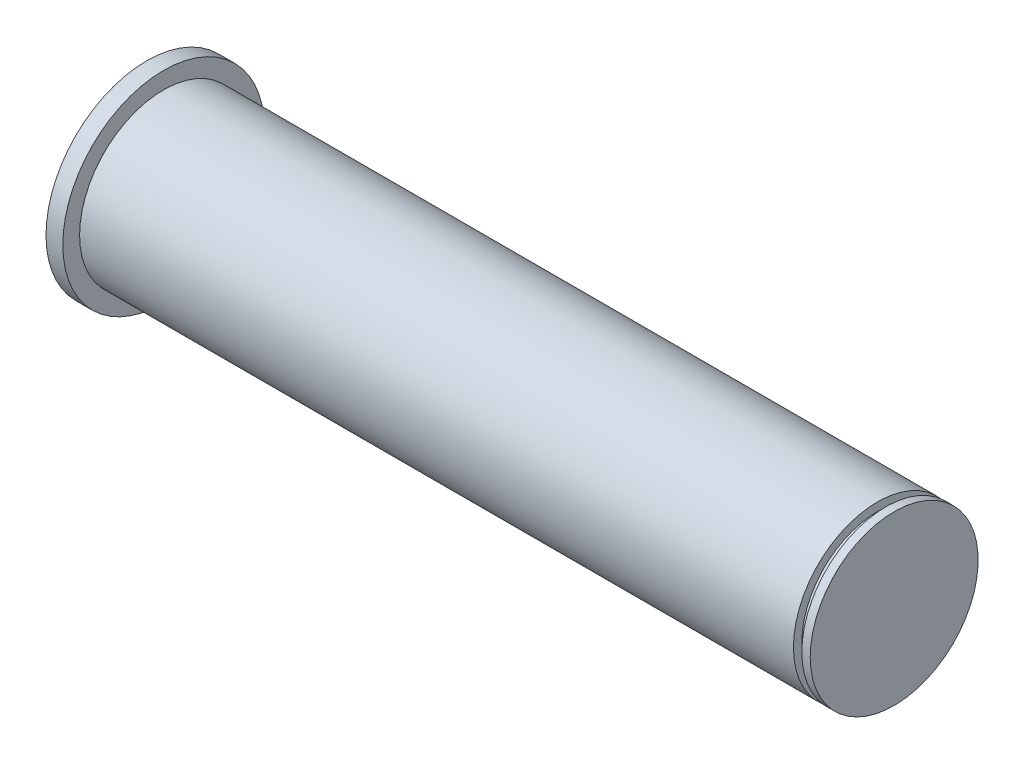
from build123d import *


with BuildPart() as part:
    # Sketch1 → Revolve1 (revolve)
    with BuildSketch(Plane.XY, mode=Mode.PRIVATE) as revolve1_sk:
        Polygon((0, 0), (0, 12), (2, 12), (2, 10), (87, 10), (87, 9), (88, 9), (88, 10), (89, 10), (89, 0), align=None)
    revolve(revolve1_sk.sketch.rotate(Axis((0, 0, 0), (1, 0, 0)), 90), axis=Axis((0, 0, 0), (1, 0, 0)))


solid = part.part
